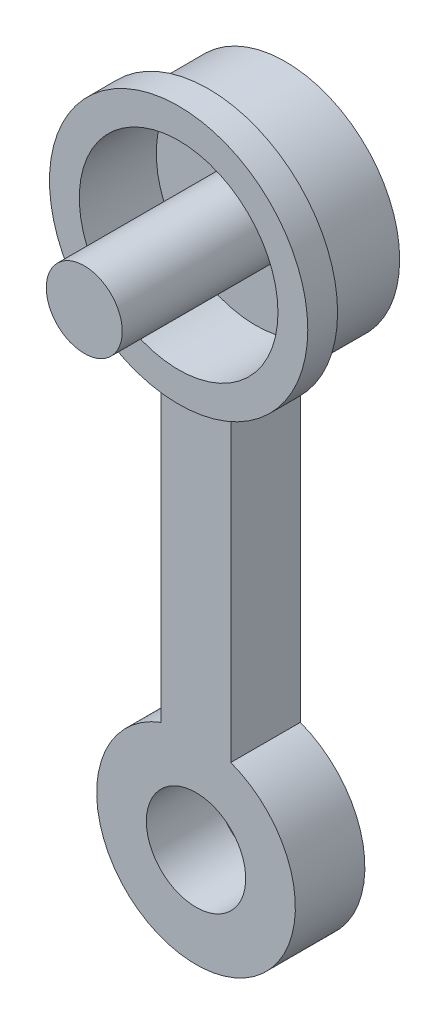
from build123d import *

# Parameters (mm, degrees)
CROQUIS1_R               = 10
SALIENTE_EXTRUIR1_DEPTH  = 3
CROQUIS2_R               = 11.5
CROQUIS2_R_2             = 10
SALIENTE_EXTRUIR3_DEPTH  = 8
SALIENTE_EXTRUIR4_START  = 3
CROQUIS3_R               = 11.5
CROQUIS3_R_2             = 10
SALIENTE_EXTRUIR4_DEPTH  = 3
SALIENTE_EXTRUIR5_DEPTH  = 8
CROQUIS11_W              = 0.560242515
CROQUIS11_H              = 6
CORTAR_EXTRUIR3_DEPTH    = 8
CROQUIS12_W              = 2.5
CROQUIS12_H              = 0.622045166
SALIENTE_EXTRUIR6_DEPTH  = 3
CROQUIS13_W              = 5
CROQUIS13_H              = 50.27502784
SALIENTE_EXTRUIR7_DEPTH  = 8
CROQUIS15_W              = 2
CROQUIS15_H              = 50.27502784
CORTAR_EXTRUIR4_DEPTH    = 8
SALIENTE_EXTRUIR8_DEPTH  = 7
CROQUIS21_R              = 10
SALIENTE_EXTRUIR9_DEPTH  = 7
CROQUIS22_R              = 5
CORTAR_EXTRUIR5_DEPTH    = 30
CROQUIS23_R              = 10
SALIENTE_EXTRUIR10_DEPTH = 1.25
CORTAR_EXTRUIR6_START    = -1.5
CROQUIS24_R              = 10
CORTAR_EXTRUIR6_DEPTH    = 1.5
SALIENTE_EXTRUIR11_START = -3
CROQUIS25_R              = 13
SALIENTE_EXTRUIR11_DEPTH = 3
CORTAR_EXTRUIR14_START   = -10
CROQUIS30_R              = 10
CORTAR_EXTRUIR14_DEPTH   = 10
CROQUIS31_R              = 11.5
CROQUIS31_R_2            = 10
SALIENTE_EXTRUIR12_DEPTH = 7.75
CROQUIS32_R              = 10
SALIENTE_EXTRUIR13_DEPTH = 10.75
CROQUIS34_R              = 10
CORTAR_EXTRUIR15_DEPTH   = 7.75
CROQUIS36_R              = 3.825
SALIENTE_EXTRUIR14_DEPTH = 7.75
CROQUIS37_R              = 3.825
SALIENTE_EXTRUIR15_DEPTH = 9.5


with BuildPart() as part:
    # Croquis1 → Saliente-Extruir1 (new body)
    with BuildSketch(Plane.XY):
        Circle(CROQUIS1_R)
    extrude(amount=SALIENTE_EXTRUIR1_DEPTH)



with BuildPart() as body_2:
    # Croquis2 → Saliente-Extruir3 (new body)
    with BuildSketch(Plane.XY.offset(3)):
        Circle(CROQUIS2_R)
        Circle(CROQUIS2_R_2, mode=Mode.SUBTRACT)
    extrude(amount=SALIENTE_EXTRUIR3_DEPTH)


with BuildPart() as part_1:
    add(part.part)

    add(body_2.part)  # Saliente-Extruir4 merges body 2
    # Croquis3 → Saliente-Extruir4 (add)
    with BuildSketch(Plane(origin=(0, 0, 3), x_dir=(-1, 0, 0), z_dir=(0, 0, -1)).offset(SALIENTE_EXTRUIR4_START)):
        with Locations(Location((0, 0, 0), (0, 0, 180))):
            Circle(CROQUIS3_R)
        with Locations(Location((0, 0, 0), (0, 0, 180))):
            Circle(CROQUIS3_R_2, mode=Mode.SUBTRACT)
    extrude(amount=-SALIENTE_EXTRUIR4_DEPTH)

    # Croquis12 → Saliente-Extruir6 (add)
    with BuildSketch(Plane.XY.offset(3)):
        with Locations((-1.25, -11.188977417)):
            Rectangle(CROQUIS12_W, CROQUIS12_H)
        with Locations((1.25, -11.188977417)):
            Rectangle(CROQUIS12_W, CROQUIS12_H)
        Polygon((2.5, -11.5), (2.5, -61.5), (-2.5, -61.5), (-2.5, -11.5), (0, -11.5), align=None)
    extrude(amount=-SALIENTE_EXTRUIR6_DEPTH)

    # Croquis13 → Saliente-Extruir7 (add)
    with BuildSketch(Plane.XY.offset(3)):
        with Locations((0, -36.36248608)):
            Rectangle(CROQUIS13_W, CROQUIS13_H)
    extrude(amount=SALIENTE_EXTRUIR7_DEPTH)

    # Croquis15 → Cortar-Extruir4 (cut)
    with BuildSketch(Plane(origin=(2.5, 0, 0), x_dir=(0, 0, -1), z_dir=(1, 0, 0))):
        with Locations((-10, -36.36248608)):
            Rectangle(CROQUIS15_W, CROQUIS15_H)
        with Locations((-1, -36.36248608)):
            Rectangle(CROQUIS15_W, CROQUIS15_H)
    extrude(amount=-CORTAR_EXTRUIR4_DEPTH, mode=Mode.SUBTRACT)

    # Croquis16 → Saliente-Extruir8 (add)
    with BuildSketch(Plane.XY.offset(9)):
        Polygon((-2.5, -61.5), (-3.5, -61.5), (-3.5, -10.232955502), (3.5, -10.232955502), (3.5, -61.5), (2.5, -61.5), align=None)
    extrude(amount=-SALIENTE_EXTRUIR8_DEPTH)

    # Croquis21 → Saliente-Extruir9 (add)
    with BuildSketch(Plane(origin=(0, 0, 2), x_dir=(-1, 0, 0), z_dir=(0, 0, -1))):
        with Locations((0, -52.72497216)):
            Circle(CROQUIS21_R)
    extrude(amount=-SALIENTE_EXTRUIR9_DEPTH)

    # Croquis22 → Cortar-Extruir5 (cut)
    with BuildSketch(Plane(origin=(0, 0, 2), x_dir=(-1, 0, 0), z_dir=(0, 0, -1))):
        with Locations((0, -52.72497216)):
            Circle(CROQUIS22_R)
    extrude(amount=-CORTAR_EXTRUIR5_DEPTH, mode=Mode.SUBTRACT)

    # Croquis23 → Saliente-Extruir10 (add)
    with BuildSketch(Plane.XY.offset(11)):
        with BuildLine():
            Line((-2.5, -11.22497216), (2.5, -11.22497216))
            ThreePointArc((2.5, -11.22497216), (0, 11.5), (-2.5, -11.22497216))
        make_face()
        Circle(CROQUIS23_R, mode=Mode.SUBTRACT)
    extrude(amount=SALIENTE_EXTRUIR10_DEPTH)

    # Croquis24 → Cortar-Extruir6 (cut)
    with BuildSketch(Plane.XY.offset(12.25).offset(CORTAR_EXTRUIR6_START)):
        with BuildLine():
            Line((-2.5, -11.22497216), (2.5, -11.22497216))
            ThreePointArc((2.5, -11.22497216), (0, 11.5), (-2.5, -11.22497216))
        make_face()
        Circle(CROQUIS24_R, mode=Mode.SUBTRACT)
    extrude(amount=CORTAR_EXTRUIR6_DEPTH, mode=Mode.SUBTRACT)

    # Croquis25 → Saliente-Extruir11 (add)
    with BuildSketch(Plane.XY.offset(10.75).offset(SALIENTE_EXTRUIR11_START)):
        Circle(CROQUIS25_R)
        with BuildLine():
            ThreePointArc((2.5, -11.22497216), (0, 11.5), (-2.5, -11.22497216))
            Line((-2.5, -11.22497216), (2.5, -11.22497216))
        make_face(mode=Mode.SUBTRACT)
    extrude(amount=SALIENTE_EXTRUIR11_DEPTH)

    # Croquis30 → Cortar-Extruir14 (cut)
    with BuildSketch(Plane.XY.offset(3).offset(CORTAR_EXTRUIR14_START)):
        Circle(CROQUIS30_R)
    extrude(amount=CORTAR_EXTRUIR14_DEPTH, mode=Mode.SUBTRACT)

    # Croquis31 → Saliente-Extruir12 (add)
    with BuildSketch(Plane(origin=(0, 0, 0), x_dir=(-1, 0, 0), z_dir=(0, 0, -1))):
        with Locations(Location((0, 0, 0), (0, 0, 180))):
            Circle(CROQUIS31_R)
        with Locations(Location((0, 0, 0), (0, 0, 180))):
            Circle(CROQUIS31_R_2, mode=Mode.SUBTRACT)
    extrude(amount=-SALIENTE_EXTRUIR12_DEPTH)

    # Croquis32 → Saliente-Extruir13 (add)
    with BuildSketch(Plane(origin=(0, 0, 0), x_dir=(-1, 0, 0), z_dir=(0, 0, -1))):
        Circle(CROQUIS32_R)
    extrude(amount=-SALIENTE_EXTRUIR13_DEPTH)

    # Croquis34 → Cortar-Extruir15 (cut)
    with BuildSketch(Plane.XY.offset(10.75)):
        Circle(CROQUIS34_R)
    extrude(amount=-CORTAR_EXTRUIR15_DEPTH, mode=Mode.SUBTRACT)

    # Croquis36 → Saliente-Extruir14 (add)
    with BuildSketch(Plane.XY.offset(3)):
        Circle(CROQUIS36_R)
    extrude(amount=SALIENTE_EXTRUIR14_DEPTH)

    # Croquis37 → Saliente-Extruir15 (add)
    with BuildSketch(Plane.XY.offset(10.75)):
        Circle(CROQUIS37_R)
    extrude(amount=SALIENTE_EXTRUIR15_DEPTH)


with BuildPart() as body_2_2:
    # Croquis9 → Saliente-Extruir5 (new body)
    with BuildSketch(Plane.XY.offset(11)):
        Polygon((11.5, 0), (11.5, 3), (12.060242515, 3), (12.060242515, -3), (11.5, -3), align=None)
    extrude(amount=-SALIENTE_EXTRUIR5_DEPTH)

    # Croquis11 → Cortar-Extruir3 (cut)
    with BuildSketch(Plane.XY.offset(11)):
        with Locations((11.780121257, 0)):
            Rectangle(CROQUIS11_W, CROQUIS11_H)
    extrude(amount=-CORTAR_EXTRUIR3_DEPTH, mode=Mode.SUBTRACT)


solid = part_1.part
